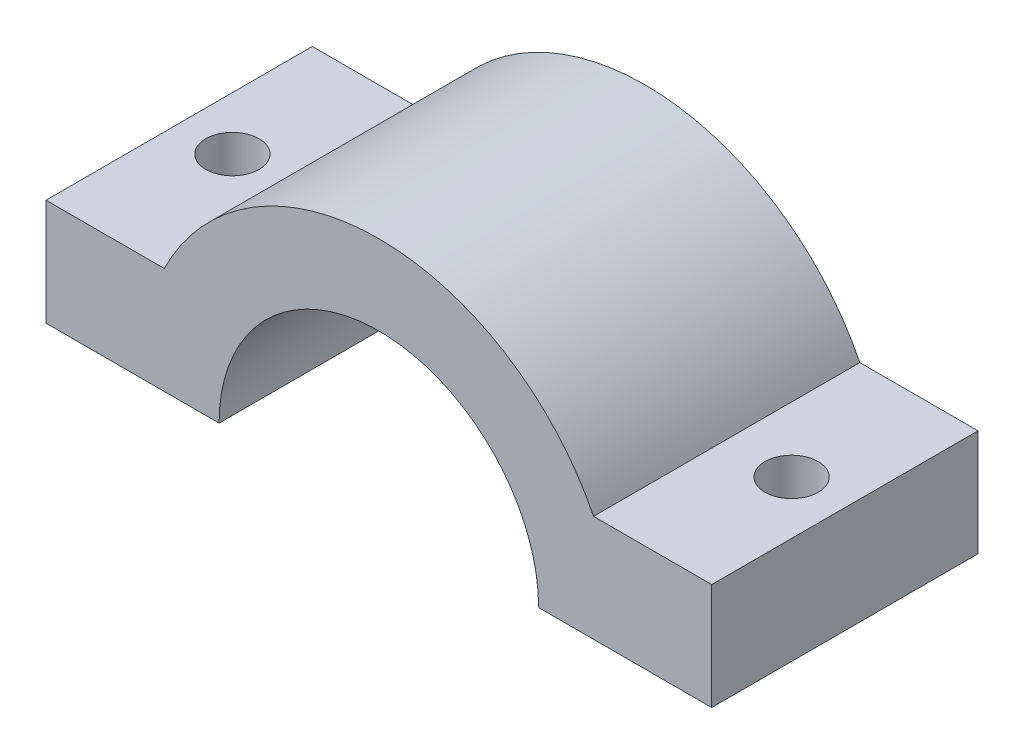
from build123d import *

# Parameters (mm, degrees)
SALIENTE_EXTRUIR1_DEPTH = 10
CROQUIS2_R              = 1
CORTAR_EXTRUIR1_DEPTH   = 10


with BuildPart() as part:
    # Croquis1 → Saliente-Extruir1 (new body)
    with BuildSketch(Plane.XY):
        with BuildLine():
            Line((12.5, -2), (6, -2))
            ThreePointArc((6, -2), (0, 4), (-6, -2))
            Line((-6, -2), (-12.5, -2))
            Line((-12.5, -2), (-12.5, 2))
            Line((-12.5, 2), (-8.062257748, 2))
            ThreePointArc((-8.062257748, 2), (0, 7), (8.062257748, 2))
            Line((8.062257748, 2), (12.5, 2))
            Line((12.5, 2), (12.5, -2))
        make_face()
    extrude(amount=SALIENTE_EXTRUIR1_DEPTH)

    # Croquis2 → Cortar-Extruir1 (cut)
    with BuildSketch(Plane(origin=(0, 2, 0), x_dir=(1, 0, 0), z_dir=(0, 1, 0))):
        with Locations(Location((10.5, -5, 0), (0, 0, 180))):
            Circle(CROQUIS2_R)
    cortar_extruir1 = extrude(amount=-CORTAR_EXTRUIR1_DEPTH, mode=Mode.SUBTRACT)

    # Simetría1: Cortar-Extruir1 across plane
    add(cortar_extruir1.mirror(Plane(origin=(0, 0, 0), x_dir=(0, 0, 1), z_dir=(1, 0, 0))), mode=Mode.SUBTRACT)


solid = part.part
